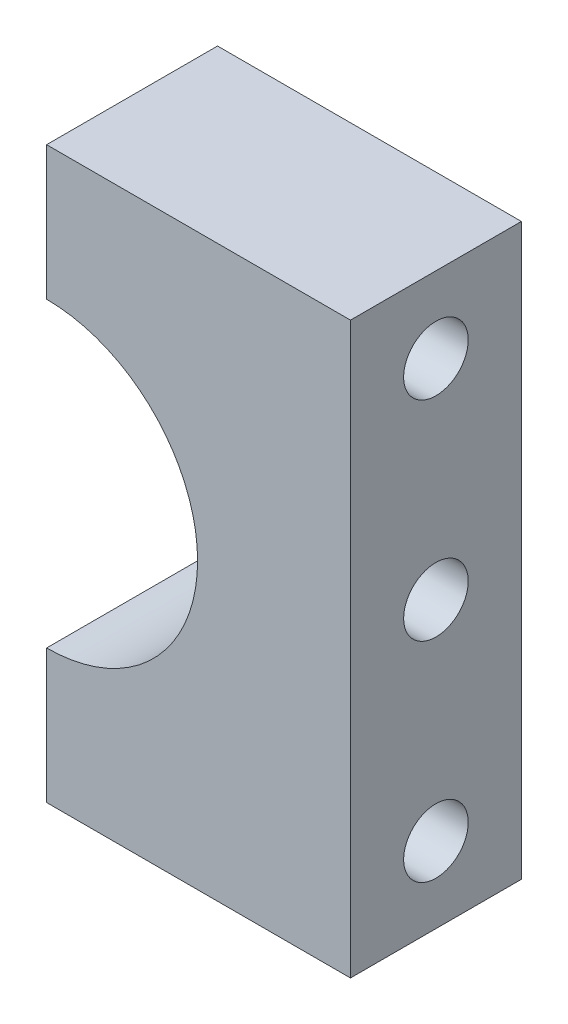
from build123d import *

# Parameters (mm, degrees)
IZIM1_R                     = 7.95
Y_KSEKLIK_EKSTR_ZYON1_DEPTH = 9
IZIM2_R                     = 1.7
KES_EKSTR_ZYON1_DEPTH       = 50
IZIM3_R                     = 1.7
KES_EKSTR_ZYON2_DEPTH       = 29
KES_EKSTR_ZYON3_DEPTH       = 10
Y_KSEKLIK_EKSTR_ZYON2_REACH = 46.777
IZIM5_W                     = 5.408103146
IZIM5_H                     = 14.931073895
IZIM6_R                     = 1.7
KES_EKSTR_ZYON4_DEPTH       = 10


with BuildPart() as part:
    # Çizim1 → Yükseklik-Ekstrüzyon1 (new body)
    with BuildSketch(Plane.XY):
        with BuildLine():
            Line((0, 0), (32, 0))
            Line((32, 0), (32, 8))
            Line((32, 8), (31.5, 8))
            ThreePointArc((31.5, 8), (28.671572875, 9.171572875), (27.5, 12))
            Line((27.5, 12), (27.5, 18))
            ThreePointArc((27.5, 18), (28.671572875, 20.828427125), (31.5, 22))
            Line((31.5, 22), (32, 22))
            Line((32, 22), (32, 30))
            Line((32, 30), (0, 30))
            Line((0, 30), (0, 22))
            Line((0, 22), (0.5, 22))
            ThreePointArc((0.5, 22), (3.328427125, 20.828427125), (4.5, 18))
            Line((4.5, 18), (4.5, 12))
            ThreePointArc((4.5, 12), (3.328427125, 9.171572875), (0.5, 8))
            Line((0.5, 8), (0, 8))
            Line((0, 8), (0, 0))
        make_face()
        with Locations((16, 15)):
            Circle(IZIM1_R, mode=Mode.SUBTRACT)
    extrude(amount=Y_KSEKLIK_EKSTR_ZYON1_DEPTH)

    # Çizim2 → Kes-Ekstrüzyon1 (cut)
    with BuildSketch(Plane(origin=(32, 0, 0), x_dir=(0, 0, -1), z_dir=(1, 0, 0))):
        with Locations((-4.5, 4)):
            Circle(IZIM2_R)
        with Locations((-4.5, 26)):
            Circle(IZIM2_R)
    extrude(amount=-KES_EKSTR_ZYON1_DEPTH, mode=Mode.SUBTRACT)

    # Çizim3 → Kes-Ekstrüzyon2 (cut)
    with BuildSketch(Plane.ZY.offset(-4.5)):
        with Locations(Location((4.5, 15, 0), (0, 0, 270))):
            Circle(IZIM3_R)
    extrude(amount=-KES_EKSTR_ZYON2_DEPTH, mode=Mode.SUBTRACT)

    # Çizim4 → Kes-Ekstrüzyon3 (cut)
    with BuildSketch(Plane(origin=(0, 0, 0), x_dir=(-1, 0, 0), z_dir=(0, 0, -1))):
        Polygon((-16, 30), (-16, 0), (9.241069926, -10.278514345), (11.843794838, 24.557008953), (11.843794838, 39.531622814), align=None)
    extrude(amount=-KES_EKSTR_ZYON3_DEPTH, mode=Mode.SUBTRACT)

    # Yükseklik-Ekstrüzyon2: up to this face of the body (flat: up to its plane)
    y_kseklik_ekstr_zyon2_end = Plane(part.part.faces().sort_by_distance((24.391799767, 15, 9))[0])
    # Çizim5 → Yükseklik-Ekstrüzyon2 (add, up to the picked face)
    with BuildSketch(Plane(origin=(0, 0, 0), x_dir=(-1, 0, 0), z_dir=(0, 0, -1)), mode=Mode.PRIVATE) as y_kseklik_ekstr_zyon2_sk1:
        with Locations((-29.295948427, 14.534463052)):
            Rectangle(IZIM5_W, IZIM5_H)
    y_kseklik_ekstr_zyon2_tool1 = split(extrude(y_kseklik_ekstr_zyon2_sk1.sketch, amount=-Y_KSEKLIK_EKSTR_ZYON2_REACH, mode=Mode.PRIVATE), bisect_by=y_kseklik_ekstr_zyon2_end, keep=Keep.BOTH, mode=Mode.PRIVATE)
    add(y_kseklik_ekstr_zyon2_tool1.solids().sort_by(Axis((29.295948, 14.534463, 0), (0, 0, 1)))[0])

    # Çizim6 → Kes-Ekstrüzyon4 (cut)
    with BuildSketch(Plane.ZY.offset(-26.591896854)):
        with Locations(Location((4.5, 15, 0), (0, 0, 270))):
            Circle(IZIM6_R)
    extrude(amount=-KES_EKSTR_ZYON4_DEPTH, mode=Mode.SUBTRACT)


solid = part.part
